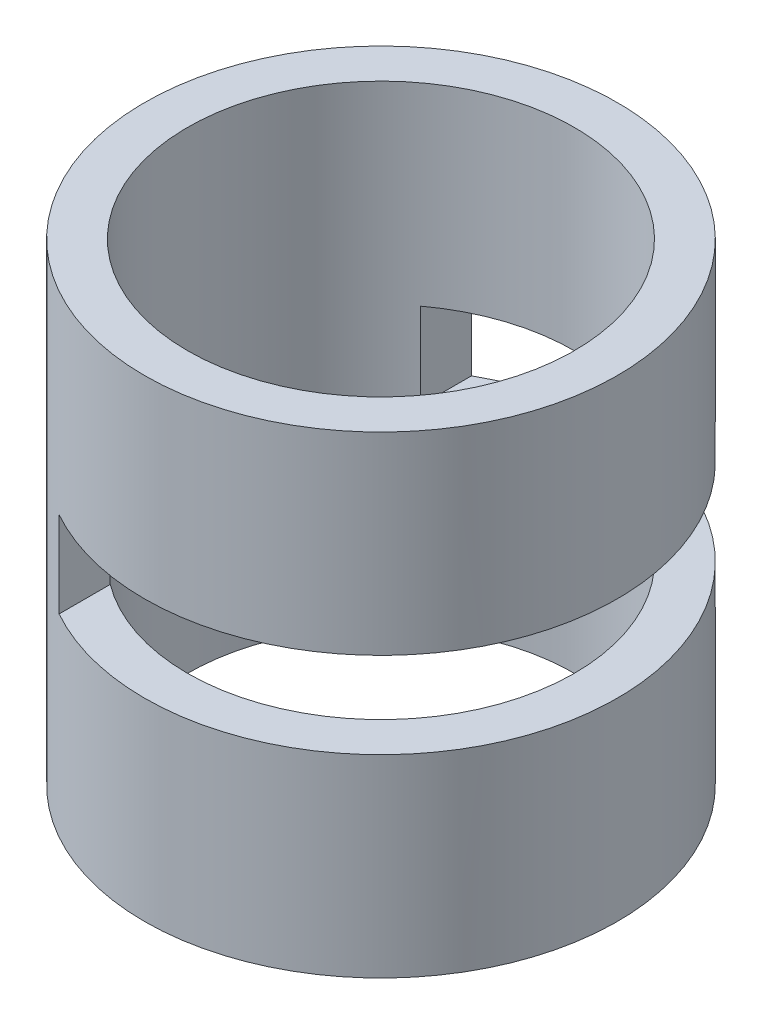
from build123d import *

# Parameters (mm, degrees)
SKETCH_1_R               = 11
SKETCH_1_R_2             = 9
EXTRUDE_1_DEPTH          = 22
CUT_EXTRUDE_2_DEPTH      = 27.944387171
CUT_EXTRUDE_2_DEPTH_BACK = 27.944387171
SKETCH_2_W               = 18.760851536
SKETCH_2_H               = 4


with BuildPart() as part:
    # 草图1 → 凸台-拉伸1 (new body)
    with BuildSketch(Plane(origin=(0, 0, 0), x_dir=(1, 0, 0), z_dir=(0, 1, 0))):
        with Locations(Location((0, 0, 0), (0, 0, 270))):
            Circle(SKETCH_1_R)
        with Locations(Location((0, 0, 0), (0, 0, 270))):
            Circle(SKETCH_1_R_2, mode=Mode.SUBTRACT)
    extrude(amount=EXTRUDE_1_DEPTH)

    # 草图2 → 切除-拉伸2 (cut, two sides: drawn at the far end of the back side and taken through both)
    with BuildSketch(Plane.XY.offset(-CUT_EXTRUDE_2_DEPTH_BACK)):
        with Locations((4.000425768, 11)):
            Rectangle(SKETCH_2_W, SKETCH_2_H)
    extrude(amount=CUT_EXTRUDE_2_DEPTH + CUT_EXTRUDE_2_DEPTH_BACK, mode=Mode.SUBTRACT)


solid = part.part
